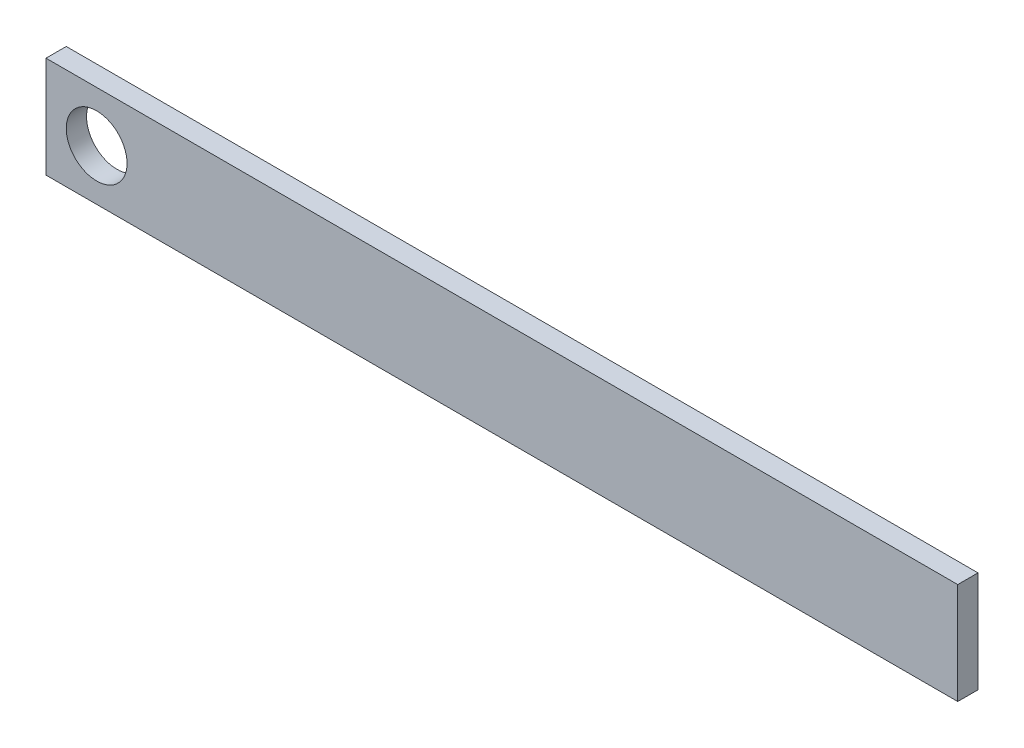
from build123d import *

# Parameters (mm, degrees)
SKETCH_1_W      = 45
SKETCH_1_H      = 5
SKETCH_1_R      = 1.5
EXTRUDE_1_DEPTH = 1


with BuildPart() as part:
    # 草图1 → 凸台-拉伸1 (new body)
    with BuildSketch(Plane.XY):
        with Locations((9.93697479, 2.5)):
            Rectangle(SKETCH_1_W, SKETCH_1_H)
        with Locations((-10.06302521, 2.5)):
            Circle(SKETCH_1_R, mode=Mode.SUBTRACT)
    extrude(amount=EXTRUDE_1_DEPTH)


solid = part.part
